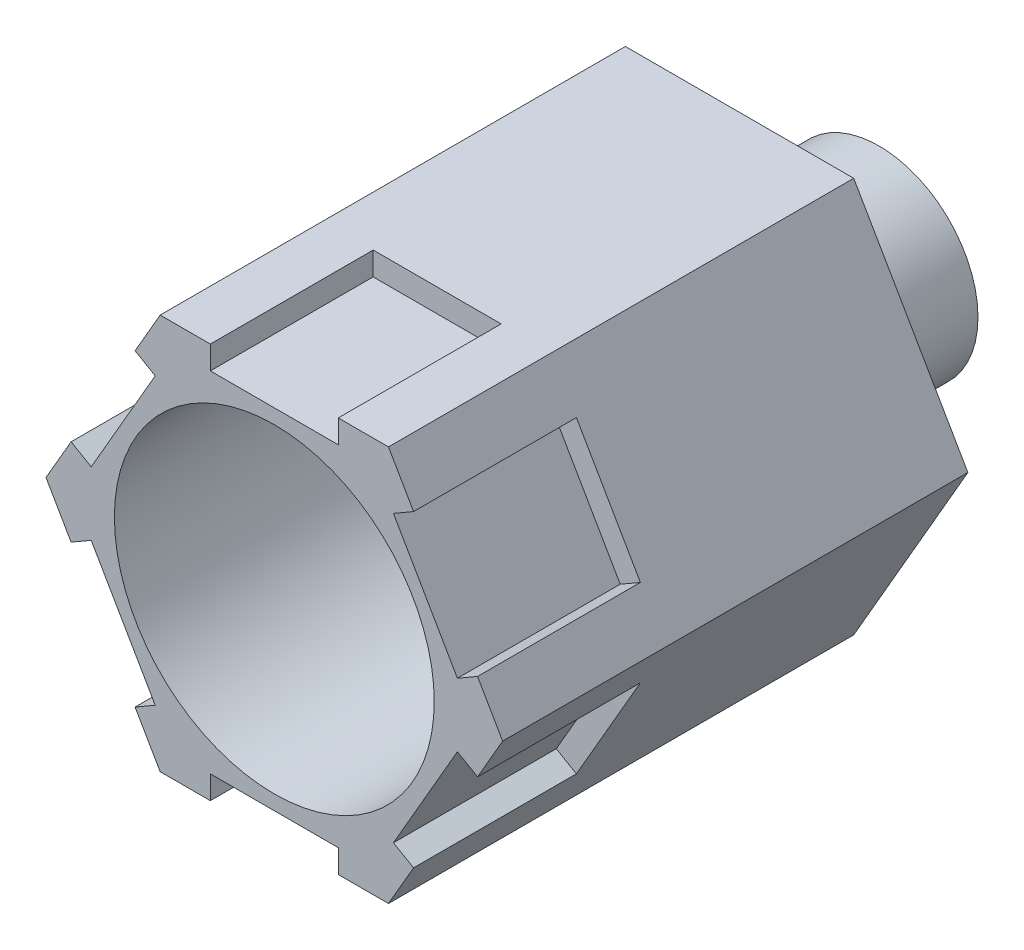
from build123d import *

# Parameters (mm, degrees)
ESQUISSE1_R             = 13.75
BOSS_EXTRU_1_DEPTH      = 38
ESQUISSE2_W             = 11
ESQUISSE2_H             = 2
ENL_V_MAT_EXTRU_1_DEPTH = 14
BOSS_EXTRU_2_DEPTH      = 2
ESQUISSE5_R             = 8.5
BOSS_EXTRU_3_DEPTH      = 12
ESQUISSE6_R             = 9.5
BOSS_EXTRU_4_DEPTH      = 1


with BuildPart() as part:
    # Esquisse1 → Boss.-Extru.1 (new body)
    with BuildSketch(Plane.XY):
        Polygon((39.259818305, 17), (29.444863729, 34), (9.814954576, 34), (0, 17), (9.814954576, 0), (29.444863729, 0), align=None)
        with Locations((19.629909152, 17)):
            Circle(ESQUISSE1_R, mode=Mode.SUBTRACT)
    extrude(amount=BOSS_EXTRU_1_DEPTH)

    # Esquisse2 → Enlèv. mat.-Extru.1 (cut)
    with BuildSketch(Plane.XY.offset(38)):
        with Locations((19.629909152, 1)):
            Rectangle(ESQUISSE2_W, ESQUISSE2_H)
        Polygon((2.157477288, 13.263139721), (7.657477288, 3.736860279), (9.389528096, 4.736860279), (3.889528096, 14.263139721), align=None)
        Polygon((7.657477288, 30.263139721), (2.157477288, 20.736860279), (3.889528096, 19.736860279), (9.389528096, 29.263139721), align=None)
        with Locations((19.629909152, 33)):
            Rectangle(ESQUISSE2_W, ESQUISSE2_H)
        Polygon((37.102341017, 20.736860279), (31.602341017, 30.263139721), (29.870290209, 29.263139721), (35.370290209, 19.736860279), align=None)
        Polygon((31.602341017, 3.736860279), (37.102341017, 13.263139721), (35.370290209, 14.263139721), (29.870290209, 4.736860279), align=None)
    extrude(amount=-ENL_V_MAT_EXTRU_1_DEPTH, mode=Mode.SUBTRACT)

    # Esquisse4 → Boss.-Extru.2 (add)
    with BuildSketch(Plane(origin=(0, 0, 0), x_dir=(-1, 0, 0), z_dir=(0, 0, -1))):
        Polygon((-39.259818305, 17), (-29.444863729, 0), (-9.814954576, 0), (0, 17), (-9.814954576, 34), (-29.444863729, 34), align=None)
    extrude(amount=BOSS_EXTRU_2_DEPTH)

    # Esquisse5 → Boss.-Extru.3 (add)
    with BuildSketch(Plane(origin=(0, 0, -2), x_dir=(-1, 0, 0), z_dir=(0, 0, -1))):
        with Locations((-19.629909152, 17)):
            Circle(ESQUISSE5_R)
    extrude(amount=BOSS_EXTRU_3_DEPTH)

    # Esquisse6 → Boss.-Extru.4 (add)
    with BuildSketch(Plane(origin=(0, 0, -2), x_dir=(-1, 0, 0), z_dir=(0, 0, -1))):
        with Locations((-19.629909152, 17)):
            Circle(ESQUISSE6_R)
    extrude(amount=BOSS_EXTRU_4_DEPTH)


solid = part.part
